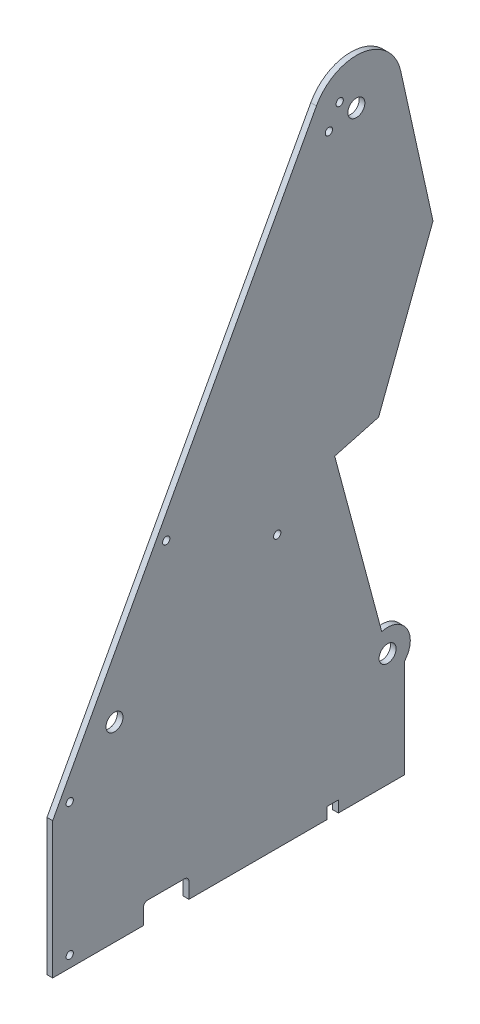
from build123d import *

# Parameters (mm, degrees)
BOSS_EXTRUDE1_DEPTH     = 3.175
SKETCH2_W               = 6.35
SKETCH2_H               = 6.35
CUT_EXTRUDE1_DEPTH      = 413.028889309
F_3_8_CLEARANCE_HOLE1_D = 9.525
SKETCH6_R               = 4.7625
CUT_EXTRUDE2_DEPTH      = 413.028889309
SKETCH10_R              = 2.032
CUT_EXTRUDE4_DEPTH      = 413.028889309
SKETCH11_R              = 2.032
CUT_EXTRUDE5_DEPTH      = 413.028889309
SKETCH13_R              = 2.032
CUT_EXTRUDE6_DEPTH      = 413.028889309
SKETCH14_R              = 2.032
CUT_EXTRUDE7_DEPTH      = 413.028889309


with BuildPart() as part:
    # Sketch1 → Boss-Extrude1 (new body)
    with BuildSketch(Plane(origin=(0, 0, 0), x_dir=(0, 0, -1), z_dir=(1, 0, 0))):
        with BuildLine():
            Line((0, 0), (0, 55.099739587))
            ThreePointArc((0, 55.099739587), (1.26919911, 70.191432251), (-12.812001873, 75.767257994))
            Line((-12.812001873, 75.767257994), (-39.108016855, 173.905321945))
            Line((-39.108016855, 173.905321945), (-14.573500867, 180.47932569))
            Line((-14.573500867, 180.47932569), (15.875, 260.35))
            Line((15.875, 260.35), (-2.186548672, 342.033868455))
            ThreePointArc((-2.186548672, 342.033868455), (-23.459772132, 361.703829452), (-49.323139542, 348.644594092))
            Line((-49.323139542, 348.644594092), (-196.85, 76.2))
            Line((-196.85, 76.2), (-196.85, 0))
            Line((-196.85, 0), (0, 0))
        make_face()
    extrude(amount=BOSS_EXTRUDE1_DEPTH)

    # Sketch2 → Cut-Extrude1 (cut, through all)
    with BuildSketch(Plane(origin=(3.175, 0, 0), x_dir=(0, 0, -1), z_dir=(1, 0, 0))):
        with BuildLine():
            Line((-146.05, 8.790931394), (-146.05, 0))
            Line((-146.05, 0), (-120.65, 0))
            Line((-120.65, 0), (-120.65, 8.790931394))
            ThreePointArc((-120.65, 8.790931394), (-121.349311849, 10.479219545), (-123.0376, 11.178531394))
            Line((-123.0376, 11.178531394), (-143.6624, 11.178531394))
            ThreePointArc((-143.6624, 11.178531394), (-145.350688151, 10.479219545), (-146.05, 8.790931394))
        make_face()
        with Locations((-40.225422327, 3.175)):
            Rectangle(SKETCH2_W, SKETCH2_H)
        with Locations((-226.474577673, 3.175)):
            Rectangle(SKETCH2_W, SKETCH2_H)
    extrude(amount=-CUT_EXTRUDE1_DEPTH, mode=Mode.SUBTRACT)

    # 3/8 Clearance Hole1 (through all)
    with Locations(Plane(origin=(3.175, 0, 0), x_dir=(0, 0, -1), z_dir=(1, 0, 0))):
        with Locations((-26.9875, 336.55), (-9.525, 63.5)):
            Hole(F_3_8_CLEARANCE_HOLE1_D / 2)

    # Sketch6 → Cut-Extrude2 (cut, through all)
    with BuildSketch(Plane(origin=(3.175, 0, 0), x_dir=(0, 0, -1), z_dir=(1, 0, 0))):
        with Locations((-162.275586362, 106.71087433)):
            Circle(SKETCH6_R)
    extrude(amount=-CUT_EXTRUDE2_DEPTH, mode=Mode.SUBTRACT)

    # Sketch10 → Cut-Extrude4 (cut, through all)
    with BuildSketch(Plane(origin=(3.175, 0, 0), x_dir=(0, 0, -1), z_dir=(1, 0, 0))):
        with Locations((-71.256645538, 151.942863158)):
            Circle(SKETCH10_R)
    extrude(amount=-CUT_EXTRUDE4_DEPTH, mode=Mode.SUBTRACT)

    # Sketch11 → Cut-Extrude5 (cut, through all)
    with BuildSketch(Plane(origin=(3.175, 0, 0), x_dir=(0, 0, -1), z_dir=(1, 0, 0))):
        with Locations((-187.325, 80.45454267)):
            Circle(SKETCH11_R)
        with Locations((-187.325, 6.35)):
            Circle(SKETCH11_R)
    extrude(amount=-CUT_EXTRUDE5_DEPTH, mode=Mode.SUBTRACT)

    # Sketch13 → Cut-Extrude6 (cut, through all)
    with BuildSketch(Plane.ZY):
        with Locations((36.31904262, 343.988077457)):
            Circle(SKETCH13_R)
        with Locations((42.366339666, 332.820257685)):
            Circle(SKETCH13_R)
    extrude(amount=-CUT_EXTRUDE6_DEPTH, mode=Mode.SUBTRACT)

    # Sketch14 → Cut-Extrude7 (cut, through all)
    with BuildSketch(Plane(origin=(3.175, 0, 0), x_dir=(0, 0, -1), z_dir=(1, 0, 0))):
        with Locations((-133.35, 180.132641428)):
            Circle(SKETCH14_R)
    extrude(amount=-CUT_EXTRUDE7_DEPTH, mode=Mode.SUBTRACT)


solid = part.part
